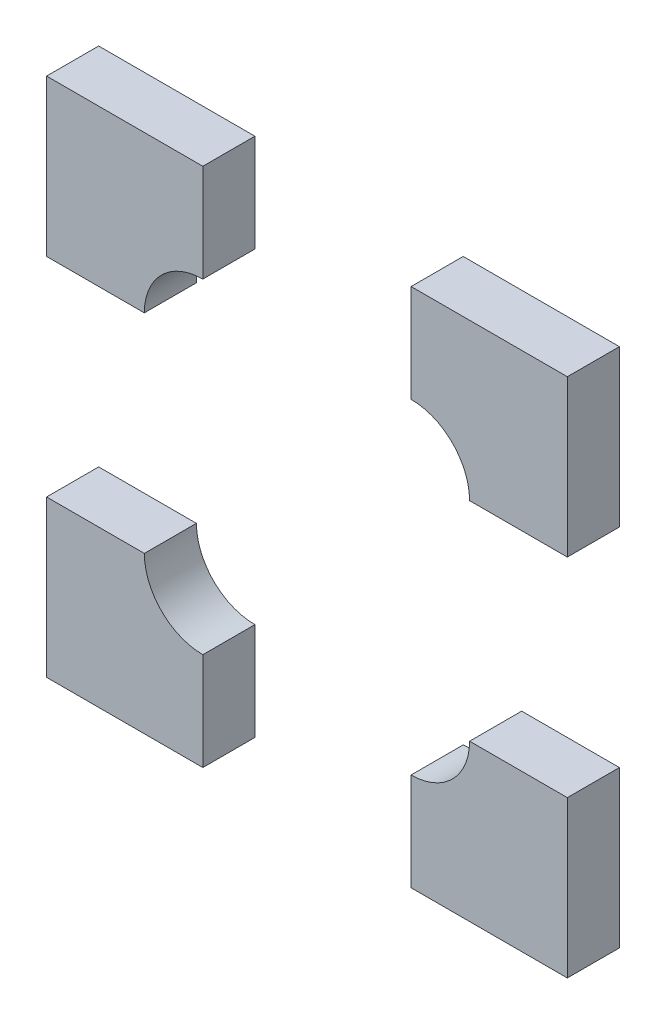
from build123d import *

# Parameters (mm, degrees)
BOSS_EXTRUDE1_DEPTH   = 1
BOSS_EXTRUDE1_2_DEPTH = 1
BOSS_EXTRUDE1_3_DEPTH = 1
BOSS_EXTRUDE1_4_DEPTH = 1


with BuildPart() as part:
    # Sketch1 → Boss-Extrude1 (new body)
    with BuildSketch(Plane.XY):
        with BuildLine():
            Line((2, -5), (5, -5))
            Line((5, -5), (5, -2))
            Line((5, -2), (3.123218099, -2))
            ThreePointArc((3.123218099, -2), (2.794235135, -2.794235135), (2, -3.123218099))
            Line((2, -3.123218099), (2, -5))
        make_face()
    extrude(amount=BOSS_EXTRUDE1_DEPTH)


with BuildPart() as body_2:
    # Sketch1 → Boss-Extrude1 2 (new body)
    with BuildSketch(Plane.XY):
        with BuildLine():
            Line((-5, -5), (-2, -5))
            Line((-2, -5), (-2, -3.123218099))
            ThreePointArc((-2, -3.123218099), (-2.794235135, -2.794235135), (-3.123218099, -2))
            Line((-3.123218099, -2), (-5, -2))
            Line((-5, -2), (-5, -5))
        make_face()
    extrude(amount=BOSS_EXTRUDE1_2_DEPTH)


with BuildPart() as body_3:
    # Sketch1 → Boss-Extrude1 3 (new body)
    with BuildSketch(Plane.XY):
        with BuildLine():
            Line((3.123218099, 2), (5, 2))
            Line((5, 2), (5, 5))
            Line((5, 5), (2, 5))
            Line((2, 5), (2, 3.123218099))
            ThreePointArc((2, 3.123218099), (2.794235135, 2.794235135), (3.123218099, 2))
        make_face()
    extrude(amount=BOSS_EXTRUDE1_3_DEPTH)


with BuildPart() as body_4:
    # Sketch1 → Boss-Extrude1 4 (new body)
    with BuildSketch(Plane.XY):
        with BuildLine():
            Line((-5, 5), (-5, 2))
            Line((-5, 2), (-3.123218099, 2))
            ThreePointArc((-3.123218099, 2), (-2.794235135, 2.794235135), (-2, 3.123218099))
            Line((-2, 3.123218099), (-2, 5))
            Line((-2, 5), (-5, 5))
        make_face()
    extrude(amount=BOSS_EXTRUDE1_4_DEPTH)


solid = Compound([part.part, body_2.part, body_3.part, body_4.part])
